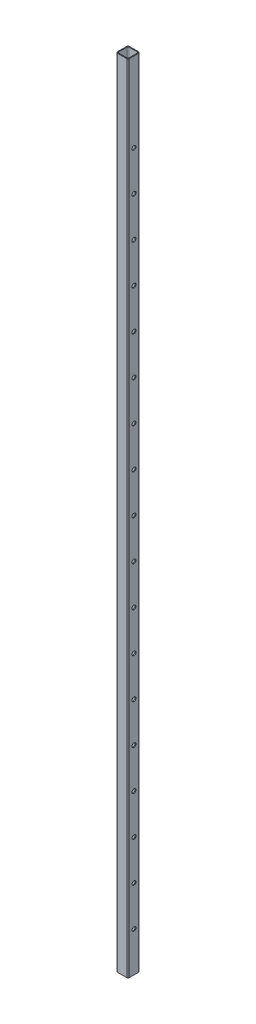
from build123d import *

# Parameters (mm, degrees)
EXTRUDE_1_DEPTH          = 2000
CUT_EXTRUDE_1_DEPTH      = 2001.112496836
CUT_EXTRUDE_1_DEPTH_BACK = 2001.112496836
SKETCH_2_R               = 5


with BuildPart() as part:
    # Эскиз1 → Бобышка-Вытянуть1 (new body)
    with BuildSketch(Plane(origin=(0, 0, 0), x_dir=(1, 0, 0), z_dir=(0, 1, 0))):
        with BuildLine():
            Line((-12, 15), (12, 15))
            ThreePointArc((12, 15), (14.121320344, 14.121320344), (15, 12))
            Line((15, 12), (15, -12))
            ThreePointArc((15, -12), (14.121320344, -14.121320344), (12, -15))
            Line((12, -15), (-12, -15))
            ThreePointArc((-12, -15), (-14.121320344, -14.121320344), (-15, -12))
            Line((-15, -12), (-15, 12))
            ThreePointArc((-15, 12), (-14.121320344, 14.121320344), (-12, 15))
        make_face()
        with BuildLine():
            Line((-11, 13), (11, 13))
            ThreePointArc((11, 13), (12.414213562, 12.414213562), (13, 11))
            Line((13, 11), (13, -11))
            ThreePointArc((13, -11), (12.414213562, -12.414213562), (11, -13))
            Line((11, -13), (-11, -13))
            ThreePointArc((-11, -13), (-12.414213562, -12.414213562), (-13, -11))
            Line((-13, -11), (-13, 11))
            ThreePointArc((-13, 11), (-12.414213562, 12.414213562), (-11, 13))
        make_face(mode=Mode.SUBTRACT)
    extrude(amount=EXTRUDE_1_DEPTH)

    # Эскиз2 → Вырез-Вытянуть1 (cut, two sides: drawn at the far end of the back side and taken through both)
    with BuildSketch(Plane(origin=(0, 0, 0), x_dir=(0, 0, -1), z_dir=(1, 0, 0)).offset(-CUT_EXTRUDE_1_DEPTH_BACK)):
        with Locations((0, 100)):
            Circle(SKETCH_2_R)
        with Locations((0, 200)):
            Circle(SKETCH_2_R)
        with Locations((0, 300)):
            Circle(SKETCH_2_R)
        with Locations((0, 400)):
            Circle(SKETCH_2_R)
        with Locations((0, 500)):
            Circle(SKETCH_2_R)
        with Locations((0, 600)):
            Circle(SKETCH_2_R)
        with Locations((0, 700)):
            Circle(SKETCH_2_R)
        with Locations((0, 800)):
            Circle(SKETCH_2_R)
        with Locations((0, 900)):
            Circle(SKETCH_2_R)
        with Locations((0, 1000)):
            Circle(SKETCH_2_R)
        with Locations((0, 1100)):
            Circle(SKETCH_2_R)
        with Locations((0, 1200)):
            Circle(SKETCH_2_R)
        with Locations((0, 1300)):
            Circle(SKETCH_2_R)
        with Locations((0, 1400)):
            Circle(SKETCH_2_R)
        with Locations((0, 1500)):
            Circle(SKETCH_2_R)
        with Locations((0, 1600)):
            Circle(SKETCH_2_R)
        with Locations((0, 1700)):
            Circle(SKETCH_2_R)
        with Locations((0, 1800)):
            Circle(SKETCH_2_R)
    extrude(amount=CUT_EXTRUDE_1_DEPTH + CUT_EXTRUDE_1_DEPTH_BACK, mode=Mode.SUBTRACT)


solid = part.part
